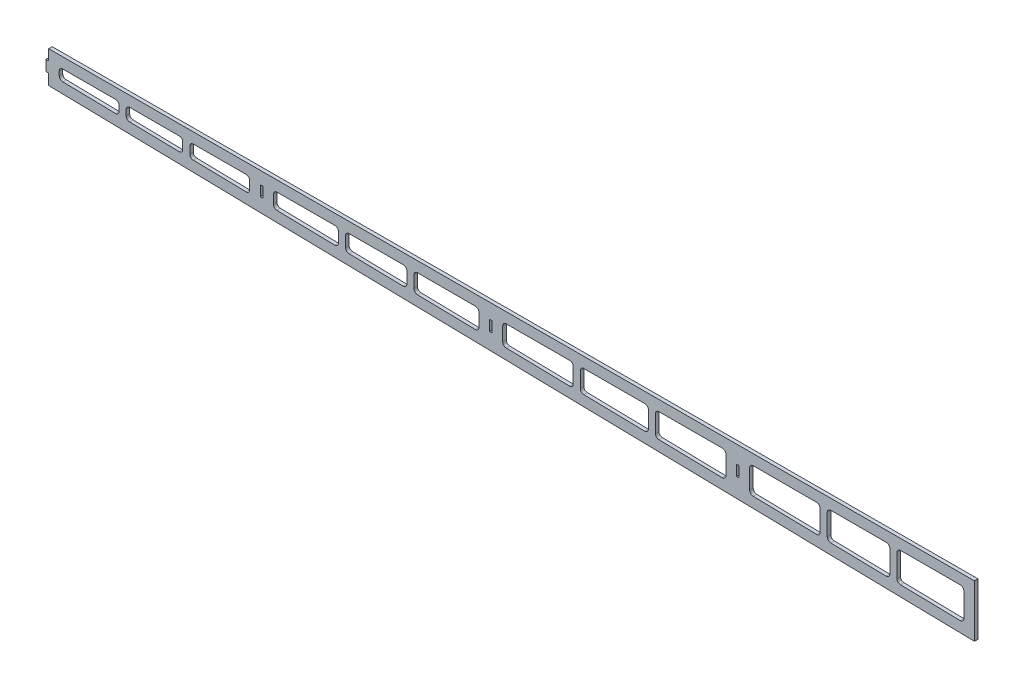
from build123d import *

# Parameters (mm, degrees)
SKETCH_2_W      = 1.5
SKETCH_2_H      = 6
EXTRUDE_2_DEPTH = 2


with BuildPart() as part:
    # 草图2 → 凸台-拉伸2 (new body)
    with BuildSketch(Plane.XY):
        Polygon((8.053783248, 22.194978349), (6.553783248, 22.194978349), (6.553783248, 28.194978349), (8.053783248, 28.194978349), (8.053783248, 34.194978349), (533.429113931, 35.353824286), (533.429113931, 5.627058882), (8.053783248, 16.095153128), align=None)
        with Locations((128.889742021, 24.455033291)):
            Rectangle(SKETCH_2_W, SKETCH_2_H, mode=Mode.SUBTRACT)
        with Locations((258.982626832, 23.318434437)):
            Rectangle(SKETCH_2_W, SKETCH_2_H, mode=Mode.SUBTRACT)
        with Locations((399.123508139, 22.161638966)):
            Rectangle(SKETCH_2_W, SKETCH_2_H, mode=Mode.SUBTRACT)
        with BuildLine():
            Line((14.053783248, 26.212604877), (14.053783248, 23.93734113))
            ThreePointArc((14.053783248, 23.93734113), (14.625552855, 22.537284723), (16.013941191, 21.937738017))
            Line((16.013941191, 21.937738017), (46.013941191, 21.339988544))
            ThreePointArc((46.013941191, 21.339988544), (47.453839655, 21.911361263), (48.053783248, 23.339591657))
            Line((48.053783248, 23.339591657), (48.053783248, 26.278777337))
            ThreePointArc((48.053783248, 26.278777337), (47.466436254, 27.694549736), (46.049371762, 28.278772471))
            Line((46.049371762, 28.278772471), (16.049371762, 28.212600011))
            ThreePointArc((16.049371762, 28.212600011), (14.638010849, 27.625257882), (14.053783248, 26.212604877))
        make_face(mode=Mode.SUBTRACT)
        with BuildLine():
            Line((52.053783248, 26.362790255), (52.053783248, 23.180191797))
            ThreePointArc((52.053783248, 23.180191797), (52.625552855, 21.78013539), (54.013941191, 21.180588684))
            Line((54.013941191, 21.180588684), (82.099899964, 20.620976448))
            ThreePointArc((82.099899964, 20.620976448), (83.539798428, 21.192349168), (84.139742021, 22.620579561))
            Line((84.139742021, 22.620579561), (84.139742021, 26.362790255))
            ThreePointArc((84.139742021, 26.362790255), (83.553955584, 27.777003817), (82.139742021, 28.362790255))
            Line((82.139742021, 28.362790255), (54.053783248, 28.362790255))
            ThreePointArc((54.053783248, 28.362790255), (52.639569686, 27.777003817), (52.053783248, 26.362790255))
        make_face(mode=Mode.SUBTRACT)
        with BuildLine():
            Line((88.139742021, 26.376019882), (88.139742021, 22.461179702))
            ThreePointArc((88.139742021, 22.461179702), (88.711511628, 21.061123295), (90.099899964, 20.461576589))
            Line((90.099899964, 20.461576589), (120.099899964, 19.863827115))
            ThreePointArc((120.099899964, 19.863827115), (121.539798428, 20.435199835), (122.139742021, 21.863430228))
            Line((122.139742021, 21.863430228), (122.139742021, 26.442192342))
            ThreePointArc((122.139742021, 26.442192342), (121.552395026, 27.857964741), (120.135330535, 28.442187476))
            Line((120.135330535, 28.442187476), (90.135330535, 28.376015016))
            ThreePointArc((90.135330535, 28.376015016), (88.723969622, 27.788672887), (88.139742021, 26.376019882))
        make_face(mode=Mode.SUBTRACT)
        with BuildLine():
            Line((135.639742021, 26.480792944), (135.639742021, 21.514743035))
            ThreePointArc((135.639742021, 21.514743035), (136.211511628, 20.114686628), (137.599899964, 19.515139922))
            Line((137.599899964, 19.515139922), (170.499899964, 18.859607999))
            ThreePointArc((170.499899964, 18.859607999), (171.939798428, 19.430980719), (172.539742021, 20.859211112))
            Line((172.539742021, 20.859211112), (172.539742021, 26.553362075))
            ThreePointArc((172.539742021, 26.553362075), (171.952395026, 27.969134474), (170.535330535, 28.553357209))
            Line((170.535330535, 28.553357209), (137.635330535, 28.480788078))
            ThreePointArc((137.635330535, 28.480788078), (136.223969622, 27.893445949), (135.639742021, 26.480792944))
        make_face(mode=Mode.SUBTRACT)
        with BuildLine():
            Line((176.539742021, 26.571008064), (176.539742021, 20.699811253))
            ThreePointArc((176.539742021, 20.699811253), (177.111511628, 19.299754846), (178.499899964, 18.70020814))
            Line((178.499899964, 18.70020814), (209.292784775, 18.08666045))
            ThreePointArc((209.292784775, 18.08666045), (210.732683239, 18.65803317), (211.332626832, 20.086263563))
            Line((211.332626832, 20.086263563), (211.332626832, 26.638929429))
            ThreePointArc((211.332626832, 26.638929429), (210.745279837, 28.054701828), (209.328215345, 28.638924564))
            Line((209.328215345, 28.638924564), (178.535330535, 28.571003199))
            ThreePointArc((178.535330535, 28.571003199), (177.123969622, 27.983661069), (176.539742021, 26.571008064))
        make_face(mode=Mode.SUBTRACT)
        with BuildLine():
            Line((215.332626832, 26.733560912), (215.332626832, 19.926863704))
            ThreePointArc((215.332626832, 19.926863704), (215.904396438, 18.526807297), (217.292784775, 17.92726059))
            Line((217.292784775, 17.92726059), (250.192784775, 17.271728668))
            ThreePointArc((250.192784775, 17.271728668), (251.632683239, 17.843101387), (252.232626832, 19.271331781))
            Line((252.232626832, 19.271331781), (252.232626832, 26.733560912))
            ThreePointArc((252.232626832, 26.733560912), (251.646840394, 28.147774475), (250.232626832, 28.733560912))
            Line((250.232626832, 28.733560912), (217.332626832, 28.733560912))
            ThreePointArc((217.332626832, 28.733560912), (215.918413269, 28.147774475), (215.332626832, 26.733560912))
        make_face(mode=Mode.SUBTRACT)
        with BuildLine():
            Line((265.732626832, 26.767745151), (265.732626832, 18.922644588))
            ThreePointArc((265.732626832, 18.922644588), (266.304396438, 17.522588181), (267.692784775, 16.923041475))
            Line((267.692784775, 16.923041475), (303.692784775, 16.205742106))
            ThreePointArc((303.692784775, 16.205742106), (305.132683239, 16.777114826), (305.732626832, 18.20534522))
            Line((305.732626832, 18.20534522), (305.732626832, 26.847152103))
            ThreePointArc((305.732626832, 26.847152103), (305.145279837, 28.262924503), (303.728215345, 28.847147238))
            Line((303.728215345, 28.847147238), (267.728215345, 28.767740286))
            ThreePointArc((267.728215345, 28.767740286), (266.316854432, 28.180398157), (265.732626832, 26.767745151))
        make_face(mode=Mode.SUBTRACT)
        with BuildLine():
            Line((309.732626832, 26.864798093), (309.732626832, 18.04594536))
            ThreePointArc((309.732626832, 18.04594536), (310.304396438, 16.645888953), (311.692784775, 16.046342247))
            Line((311.692784775, 16.046342247), (346.333666082, 15.356123294))
            ThreePointArc((346.333666082, 15.356123294), (347.773564547, 15.927496014), (348.373508139, 17.355726408))
            Line((348.373508139, 17.355726408), (348.373508139, 26.941207171))
            ThreePointArc((348.373508139, 26.941207171), (347.786161145, 28.35697957), (346.369096653, 28.941202305))
            Line((346.369096653, 28.941202305), (311.728215345, 28.864793227))
            ThreePointArc((311.728215345, 28.864793227), (310.316854432, 28.277451098), (309.732626832, 26.864798093))
        make_face(mode=Mode.SUBTRACT)
        with BuildLine():
            Line((352.373508139, 26.95885316), (352.373508139, 17.196326548))
            ThreePointArc((352.373508139, 17.196326548), (352.945277746, 15.796270141), (354.333666082, 15.196723435))
            Line((354.333666082, 15.196723435), (390.333666082, 14.479424066))
            ThreePointArc((390.333666082, 14.479424066), (391.773564547, 15.050796786), (392.373508139, 16.47902718))
            Line((392.373508139, 16.47902718), (392.373508139, 27.038260112))
            ThreePointArc((392.373508139, 27.038260112), (391.786161145, 28.454032511), (390.369096653, 29.038255247))
            Line((390.369096653, 29.038255247), (354.369096653, 28.958848295))
            ThreePointArc((354.369096653, 28.958848295), (352.95773574, 28.371506165), (352.373508139, 26.95885316))
        make_face(mode=Mode.SUBTRACT)
        with BuildLine():
            Line((405.873508139, 27.160684029), (405.873508139, 16.130339987))
            ThreePointArc((405.873508139, 16.130339987), (406.445277746, 14.73028358), (407.833666082, 14.130736874))
            Line((407.833666082, 14.130736874), (443.833666082, 13.413437505))
            ThreePointArc((443.833666082, 13.413437505), (445.273564547, 13.984810225), (445.873508139, 15.413040618))
            Line((445.873508139, 15.413040618), (445.873508139, 27.160684029))
            ThreePointArc((445.873508139, 27.160684029), (445.287721702, 28.574897591), (443.873508139, 29.160684029))
            Line((443.873508139, 29.160684029), (407.873508139, 29.160684029))
            ThreePointArc((407.873508139, 29.160684029), (406.459294577, 28.574897591), (405.873508139, 27.160684029))
        make_face(mode=Mode.SUBTRACT)
        with BuildLine():
            Line((449.873508139, 27.247933753), (449.873508139, 15.253640759))
            ThreePointArc((449.873508139, 15.253640759), (450.445277746, 13.853584352), (451.833666082, 13.254037646))
            Line((451.833666082, 13.254037646), (483.389271874, 12.625292754))
            ThreePointArc((483.389271874, 12.625292754), (484.829170338, 13.196665474), (485.429113931, 14.624895867))
            Line((485.429113931, 14.624895867), (485.429113931, 27.247933753))
            ThreePointArc((485.429113931, 27.247933753), (484.843327493, 28.662147316), (483.429113931, 29.247933753))
            Line((483.429113931, 29.247933753), (451.873508139, 29.247933753))
            ThreePointArc((451.873508139, 29.247933753), (450.459294577, 28.662147316), (449.873508139, 27.247933753))
        make_face(mode=Mode.SUBTRACT)
        with BuildLine():
            Line((489.429113931, 27.340575198), (489.429113931, 14.465496007))
            ThreePointArc((489.429113931, 14.465496007), (490.000883538, 13.0654396), (491.389271874, 12.465892894))
            Line((491.389271874, 12.465892894), (525.389271874, 11.788443491))
            ThreePointArc((525.389271874, 11.788443491), (526.829170338, 12.35981621), (527.429113931, 13.788046604))
            Line((527.429113931, 13.788046604), (527.429113931, 27.340575198))
            ThreePointArc((527.429113931, 27.340575198), (526.843327493, 28.75478876), (525.429113931, 29.340575198))
            Line((525.429113931, 29.340575198), (491.429113931, 29.340575198))
            ThreePointArc((491.429113931, 29.340575198), (490.014900369, 28.75478876), (489.429113931, 27.340575198))
        make_face(mode=Mode.SUBTRACT)
    extrude(amount=EXTRUDE_2_DEPTH)


solid = part.part
